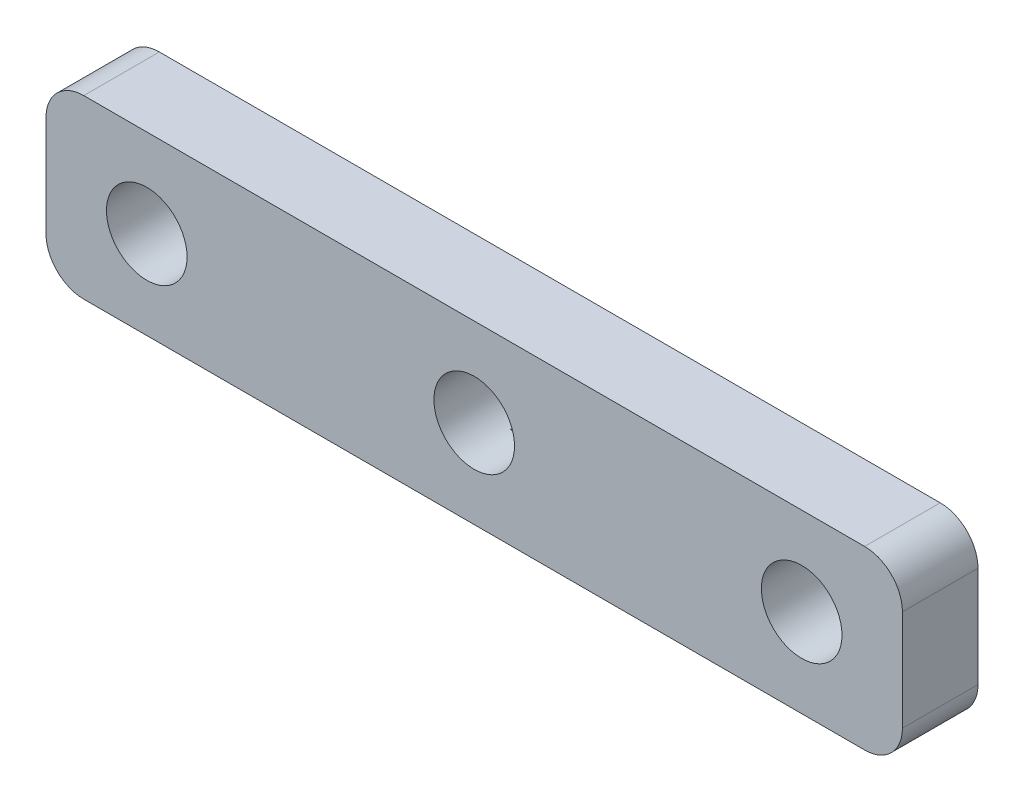
from build123d import *

# Parameters (mm, degrees)
SKETCH1_W           = 34
SKETCH1_H           = 7
SKETCH1_R           = 1.6
BOSS_EXTRUDE1_DEPTH = 3
SKETCH2_W           = 18
SKETCH2_H           = 1
CUT_EXTRUDE1_DEPTH  = 1
FILLET1_R           = 1.5


with BuildPart() as part:
    # Sketch1 → Boss-Extrude1 (new body)
    with BuildSketch(Plane.XY):
        with Locations((17, 3.5)):
            Rectangle(SKETCH1_W, SKETCH1_H)
        with Locations((4, 3.5)):
            Circle(SKETCH1_R, mode=Mode.SUBTRACT)
        with Locations((30, 3.5)):
            Circle(SKETCH1_R, mode=Mode.SUBTRACT)
        with Locations((17, 3.5)):
            Circle(SKETCH1_R, mode=Mode.SUBTRACT)
    extrude(amount=BOSS_EXTRUDE1_DEPTH)

    # Sketch2 → Cut-Extrude1 (cut)
    with BuildSketch(Plane(origin=(0, 0, 0), x_dir=(-1, 0, 0), z_dir=(0, 0, -1))):
        with Locations((-17, 7.5)):
            Rectangle(SKETCH2_W, SKETCH2_H)
        with Locations((-17, 5.5)):
            Rectangle(SKETCH2_W, SKETCH2_H)
        with Locations((-17, 3.5)):
            Rectangle(SKETCH2_W, SKETCH2_H)
        with Locations((-17, 1.5)):
            Rectangle(SKETCH2_W, SKETCH2_H)
        with Locations((-17, -0.5)):
            Rectangle(SKETCH2_W, SKETCH2_H)
    extrude(amount=-CUT_EXTRUDE1_DEPTH, mode=Mode.SUBTRACT)

    # Fillet1
    fillet1_edges = [part.edges().sort_by_distance(p)[0] for p in [
        (0, 7, 1.5),
        (34, 7, 1.5),
        (34, 0, 1.5),
        (0, 0, 1.5),
    ]]
    fillet(fillet1_edges, radius=FILLET1_R)


solid = part.part
